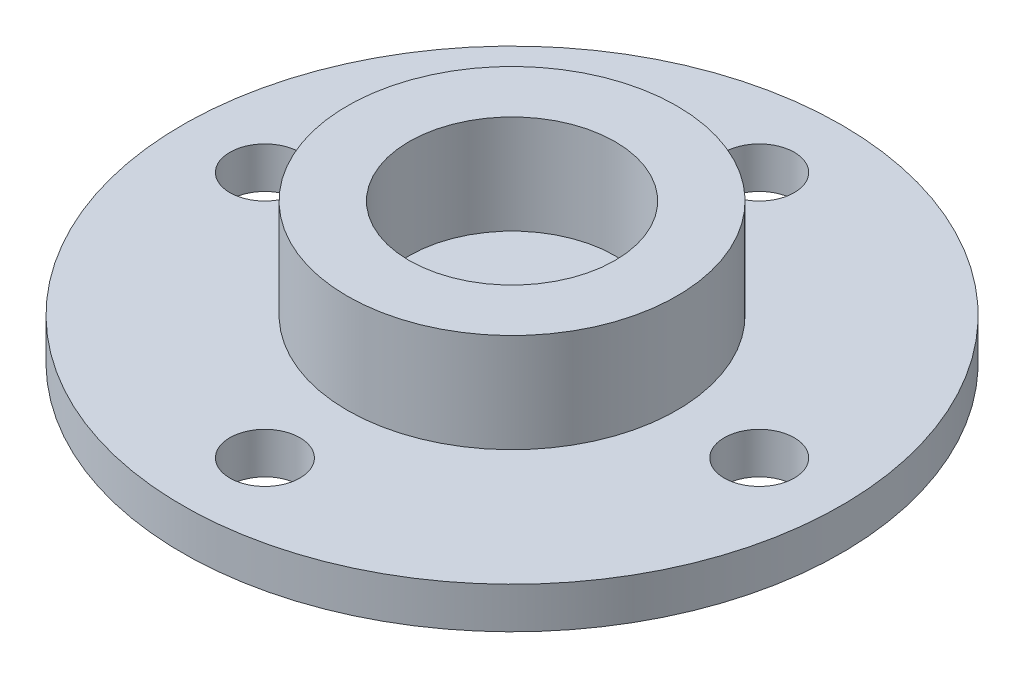
from build123d import *

# Parameters (mm, degrees)
SKETCH2_R          = 4.25
CUT_EXTRUDE1_DEPTH = 10


with BuildPart() as part:
    # Sketch1 → Revolve1 (revolve)
    with BuildSketch(Plane.XY, mode=Mode.PRIVATE) as revolve1_sk:
        Polygon((4.5, 5), (12.5, 5), (12.5, 17), (20, 17), (20, 5), (40, 5), (40, 0), (4.5, 0), align=None)
    revolve(revolve1_sk.sketch.rotate(Axis((0, 0, 0), (0, 1, 0)), 90), axis=Axis((0, 0, 0), (0, 1, 0)))

    # Sketch2 → Cut-Extrude1 (cut)
    with BuildSketch(Plane.XZ):
        with Locations(Location((0, 30, 0), (0, 0, 270))):
            Circle(SKETCH2_R)
        with Locations(Location((30, 0, 0), (0, 0, 270))):
            Circle(SKETCH2_R)
        with Locations(Location((0, -30, 0), (0, 0, 270))):
            Circle(SKETCH2_R)
        with Locations(Location((-30, 0, 0), (0, 0, 270))):
            Circle(SKETCH2_R)
    extrude(amount=-CUT_EXTRUDE1_DEPTH, mode=Mode.SUBTRACT)


solid = part.part
